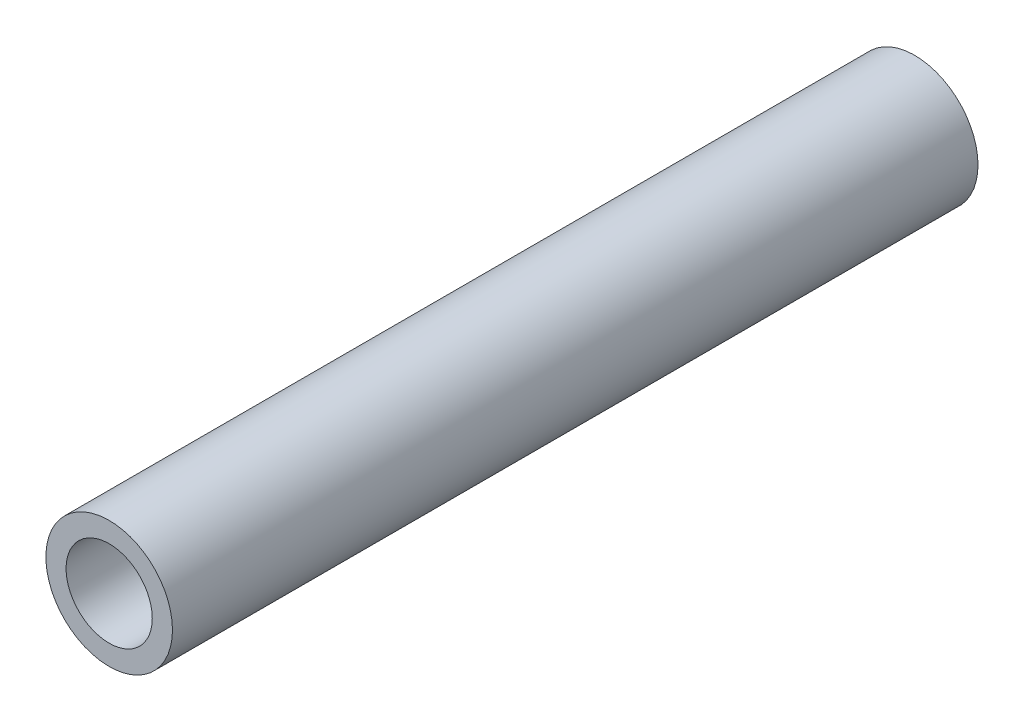
from build123d import *

# Parameters (mm, degrees)
BOSS_EXTRUDE1_DEPTH      = 100
BOSS_EXTRUDE1_DEPTH_BACK = 40
SKETCH1_R                = 11
SKETCH1_R_2              = 7.49


with BuildPart() as part:
    # Sketch1 → Boss-Extrude1 (new, two sides: drawn at the far end of the back side and taken through both)
    with BuildSketch(Plane.XY.offset(-BOSS_EXTRUDE1_DEPTH_BACK)):
        with Locations((164.15, 2168.810006202)):
            Circle(SKETCH1_R)
        with Locations((164.15, 2168.810006202)):
            Circle(SKETCH1_R_2, mode=Mode.SUBTRACT)
    extrude(amount=BOSS_EXTRUDE1_DEPTH + BOSS_EXTRUDE1_DEPTH_BACK)


solid = part.part
